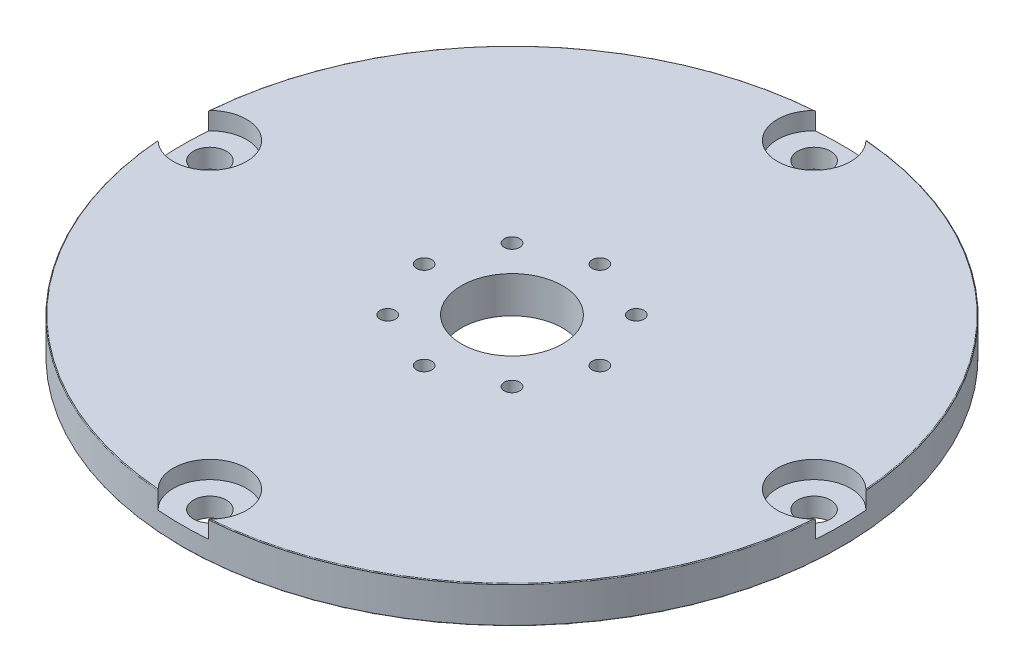
from build123d import *

# Parameters (mm, degrees)
ESQUISSE2_R             = 45
ESQUISSE2_R_2           = 1.55
BOSS_EXTRU_1_DEPTH      = 6.5
ENL_V_START             = -1.5
ESQUISSE3_R             = 45
ESQUISSE3_R_2           = 6
ENL_V_MAT_EXTRU_1_DEPTH = 1.5
CONG_1_R                = 0.1
ESQUISSE5_R             = 4
ENL_V_MAT_EXTRU_3_DEPTH = 5.5
SKETCH1_R               = 2.25
CUT_EXTRUDE1_DEPTH      = 64.835726815
SKETCH2_R               = 1.05
CUT_EXTRUDE2_DEPTH      = 64.970696557
CIRPATTERN1_COUNT       = 8
SKETCH6_R               = 6.9
CUT_EXTRUDE3_DEPTH      = 10
SKETCH7_R               = 5
CUT_EXTRUDE4_DEPTH      = 2.4


with BuildPart() as part:
    # Esquisse2 → Boss.-Extru.1 (new body)
    with BuildSketch(Plane(origin=(0, 0, 0), x_dir=(1, 0, 0), z_dir=(0, 1, 0))):
        with Locations(Location((0, 0, 0), (0, 0, 90))):
            Circle(ESQUISSE2_R)
        with Locations(Location((0, 0, 0), (0, 0, 90))):
            Circle(ESQUISSE2_R_2, mode=Mode.SUBTRACT)
    extrude(amount=BOSS_EXTRU_1_DEPTH)

    # Esquisse3 → Enlèv. mat.-Extru.1 (cut)
    with BuildSketch(Plane(origin=(0, 6.5, 0), x_dir=(1, 0, 0), z_dir=(0, 1, 0)).offset(ENL_V_START)):
        with Locations(Location((0, 0, 0), (0, 0, 90))):
            Circle(ESQUISSE3_R)
        with Locations(Location((0, 0, 0), (0, 0, 270))):
            Circle(ESQUISSE3_R_2, mode=Mode.SUBTRACT)
    extrude(amount=ENL_V_MAT_EXTRU_1_DEPTH, mode=Mode.SUBTRACT)

    # Congé1
    cong_1_edges = [part.edges().sort_by_distance(p)[0] for p in [
        (0, 5, 45),
        (0, 5, -6),
        (0, 6.5, -6),
        (0, 0, 45),
        (0, 6.5, 1.55),
    ]]
    fillet(cong_1_edges, radius=CONG_1_R)

    # Esquisse5 → Enlèv. mat.-Extru.3 (cut)
    with BuildSketch(Plane.XZ):
        with Locations(Location((0, 0, 0), (0, 0, 270))):
            Circle(ESQUISSE5_R)
    extrude(amount=-ENL_V_MAT_EXTRU_3_DEPTH, mode=Mode.SUBTRACT)

    # Sketch1 → Cut-Extrude1 (cut, through all)
    with BuildSketch(Plane(origin=(0, 5, 0), x_dir=(1, 0, 0), z_dir=(0, 1, 0))):
        with Locations(Location((0, 41.25, 0), (0, 0, 270))):
            Circle(SKETCH1_R)
        with Locations(Location((41.25, 0, 0), (0, 0, 270))):
            Circle(SKETCH1_R)
        with Locations(Location((0, -41.25, 0), (0, 0, 90))):
            Circle(SKETCH1_R)
        with Locations(Location((-41.25, 0, 0), (0, 0, 90))):
            Circle(SKETCH1_R)
    extrude(amount=-CUT_EXTRUDE1_DEPTH, mode=Mode.SUBTRACT)

    # Sketch2 → Cut-Extrude2 (cut, through all)
    with BuildSketch(Plane.XZ):
        with Locations(Location((0, 12, 0), (0, 0, 270))):
            Circle(SKETCH2_R)
    cut_extrude2 = extrude(amount=-CUT_EXTRUDE2_DEPTH, mode=Mode.SUBTRACT)

    # CirPattern1: Cut-Extrude2 ×8 about axis
    cirpattern1_axis = Axis((0, 0, 0), (0, 1, 0))
    for i in range(1, CIRPATTERN1_COUNT):
        add(cut_extrude2.rotate(cirpattern1_axis, i * 360 / CIRPATTERN1_COUNT), mode=Mode.SUBTRACT)

    # Sketch6 → Cut-Extrude3 (cut)
    with BuildSketch(Plane(origin=(0, 6.5, 0), x_dir=(1, 0, 0), z_dir=(0, 1, 0))):
        with Locations(Location((0, 0, 0), (0, 0, 270))):
            Circle(SKETCH6_R)
    extrude(amount=-CUT_EXTRUDE3_DEPTH, mode=Mode.SUBTRACT)

    # Sketch7 → Cut-Extrude4 (cut)
    with BuildSketch(Plane(origin=(0, 5, 0), x_dir=(1, 0, 0), z_dir=(0, 1, 0))):
        with Locations((-41.25, 0)):
            Circle(SKETCH7_R)
        with Locations((0, 41.25)):
            Circle(SKETCH7_R)
        with Locations((41.25, 0)):
            Circle(SKETCH7_R)
        with Locations((0, -41.25)):
            Circle(SKETCH7_R)
    extrude(amount=-CUT_EXTRUDE4_DEPTH, mode=Mode.SUBTRACT)


solid = part.part
